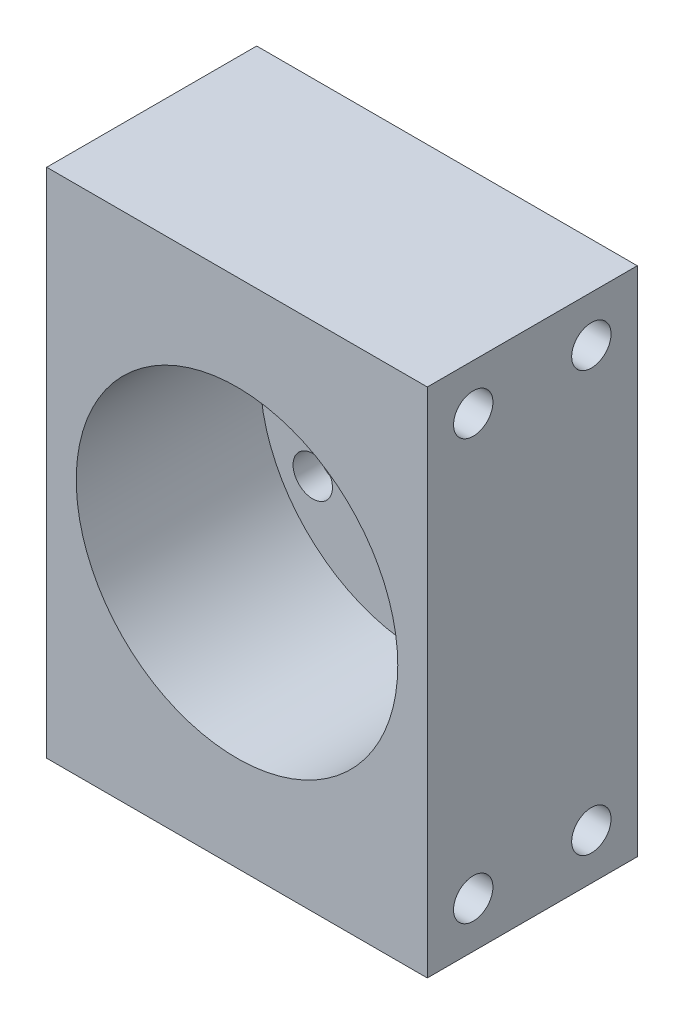
from build123d import *

# Parameters (mm, degrees)
SKETCH_1_W          = 29
SKETCH_1_H          = 39
EXTRUDE_1_DEPTH     = 16
SKETCH_2_R          = 12.25
CUT_EXTRUDE_1_DEPTH = 14
SKETCH_3_R          = 6.75
CUT_EXTRUDE_2_DEPTH = 14
SKETCH_4_R          = 1.5
CUT_EXTRUDE_3_DEPTH = 14
SKETCH_5_R          = 1.5
CUT_EXTRUDE_4_DEPTH = 10
CUT_EXTRUDE_START   = -10
SKETCH_6_R          = 1.5
CUT_EXTRUDE_6_DEPTH = 10


with BuildPart() as part:
    # 草图1 → 凸台-拉伸1 (new body)
    with BuildSketch(Plane.XY):
        with Locations((13.362025316, 5)):
            Rectangle(SKETCH_1_W, SKETCH_1_H)
    extrude(amount=EXTRUDE_1_DEPTH)

    # 草图2 → 切除-拉伸1 (cut)
    with BuildSketch(Plane.XY.offset(16)):
        with Locations((13.362025316, 5)):
            Circle(SKETCH_2_R)
    extrude(amount=-CUT_EXTRUDE_1_DEPTH, mode=Mode.SUBTRACT)

    # 草图3 → 切除-拉伸2 (cut)
    with BuildSketch(Plane(origin=(0, 0, 0), x_dir=(-1, 0, 0), z_dir=(0, 0, -1))):
        with Locations((-13.362025316, 5)):
            Circle(SKETCH_3_R)
    extrude(amount=-CUT_EXTRUDE_2_DEPTH, mode=Mode.SUBTRACT)

    # 草图4 → 切除-拉伸3 (cut)
    with BuildSketch(Plane(origin=(0, 0, 0), x_dir=(-1, 0, 0), z_dir=(0, 0, -1))):
        with Locations((-13.362025316, 14.5)):
            Circle(SKETCH_4_R)
        with Locations((-5.134783981, 9.75)):
            Circle(SKETCH_4_R)
        with Locations((-5.134783981, 0.25)):
            Circle(SKETCH_4_R)
        with Locations((-13.362025316, -4.5)):
            Circle(SKETCH_4_R)
        with Locations((-21.589266652, 0.25)):
            Circle(SKETCH_4_R)
        with Locations((-21.589266652, 9.75)):
            Circle(SKETCH_4_R)
    extrude(amount=-CUT_EXTRUDE_3_DEPTH, mode=Mode.SUBTRACT)

    # 草图5 → 切除-拉伸4 (cut)
    with BuildSketch(Plane.ZY.offset(1.137974684)):
        with Locations((12.5, 21)):
            Circle(SKETCH_5_R)
        with Locations(Location((3.5, 21, 0), (0, 0, 180))):
            Circle(SKETCH_5_R)
        with Locations(Location((12.5, -11, 0), (0, 0, 180))):
            Circle(SKETCH_5_R)
        with Locations((3.5, -11)):
            Circle(SKETCH_5_R)
    extrude(amount=-CUT_EXTRUDE_4_DEPTH, mode=Mode.SUBTRACT)

    # 草图6 → 切除-拉伸6 (cut)
    with BuildSketch(Plane(origin=(27.862025316, 0, 0), x_dir=(0, 0, -1), z_dir=(1, 0, 0)).offset(CUT_EXTRUDE_START)):
        with Locations((-12.5, -11)):
            Circle(SKETCH_6_R)
        with Locations(Location((-3.5, -11, 0), (0, 0, 180))):
            Circle(SKETCH_6_R)
        with Locations((-3.5, 21)):
            Circle(SKETCH_6_R)
        with Locations(Location((-12.5, 21, 0), (0, 0, 180))):
            Circle(SKETCH_6_R)
    extrude(amount=CUT_EXTRUDE_6_DEPTH, mode=Mode.SUBTRACT)


solid = part.part
